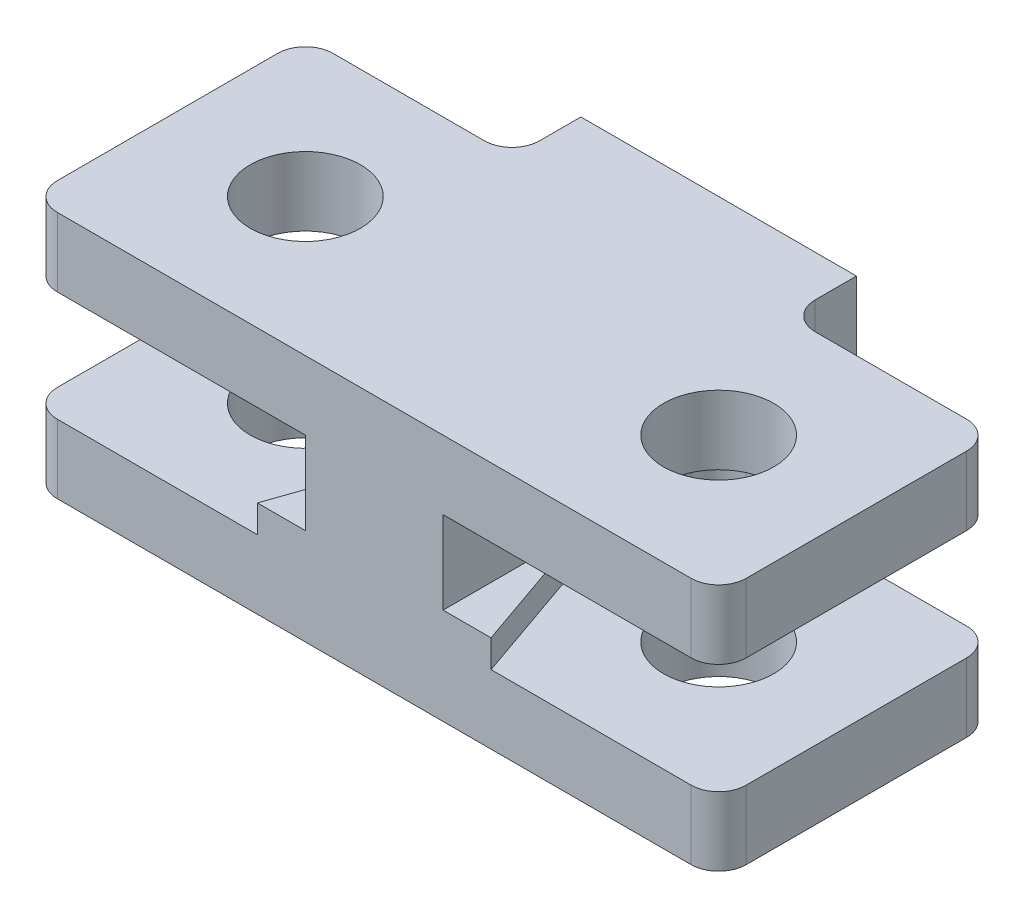
from build123d import *

# Parameters (mm, degrees)
SKETCH1_W           = 50
SKETCH1_H           = 20
BOSS_EXTRUDE1_DEPTH = 5
SKETCH2_R           = 4
CUT_EXTRUDE1_DEPTH  = 5
SKETCH3_W           = 10
SKETCH3_H           = 20
BOSS_EXTRUDE2_DEPTH = 8
FILLET1_R           = 2
SKETCH5_W           = 20
SKETCH5_H           = 18
BOSS_EXTRUDE3_DEPTH = 5
SKETCH6_R           = 4
CUT_EXTRUDE2_DEPTH  = 5
FILLET2_R           = 2
BOSS_EXTRUDE4_DEPTH = 2


with BuildPart() as part:
    # Sketch1 → Boss-Extrude1 (new body)
    with BuildSketch(Plane(origin=(0, 0, 0), x_dir=(1, 0, 0), z_dir=(0, 1, 0))):
        Rectangle(SKETCH1_W, SKETCH1_H)
    boss_extrude1 = extrude(amount=BOSS_EXTRUDE1_DEPTH)

    # Sketch2 → Cut-Extrude1 (cut)
    with BuildSketch(Plane(origin=(0, 5, 0), x_dir=(1, 0, 0), z_dir=(0, 1, 0))):
        with Locations((-15, 0)):
            Circle(SKETCH2_R)
        with Locations((15, 0)):
            Circle(SKETCH2_R)
    cut_extrude1 = extrude(amount=-CUT_EXTRUDE1_DEPTH, mode=Mode.SUBTRACT)

    # Sketch3 → Boss-Extrude2 (add)
    with BuildSketch(Plane(origin=(0, 5, 0), x_dir=(1, 0, 0), z_dir=(0, 1, 0))):
        Rectangle(SKETCH3_W, SKETCH3_H)
    extrude(amount=BOSS_EXTRUDE2_DEPTH)

    # Mirror1: Boss-Extrude1, Cut-Extrude1 across plane
    add(boss_extrude1.mirror(Plane.ZX.offset(9)))
    add(cut_extrude1.mirror(Plane.ZX.offset(9)), mode=Mode.SUBTRACT)

    # Fillet1
    fillet1_edges = [part.edges().sort_by_distance(p)[0] for p in [
        (25, 2.5, -10),
        (25, 15.5, -10),
        (25, 15.5, 10),
        (25, 2.5, 10),
        (-25, 15.5, -10),
        (-25, 15.5, 10),
        (-25, 2.5, 10),
        (-25, 2.5, -10),
    ]]
    fillet(fillet1_edges, radius=FILLET1_R)

    # Sketch5 → Boss-Extrude3 (add)
    with BuildSketch(Plane.XY.offset(-10)):
        with Locations((0, 9)):
            Rectangle(SKETCH5_W, SKETCH5_H)
    extrude(amount=-BOSS_EXTRUDE3_DEPTH)

    # Sketch6 → Cut-Extrude2 (cut)
    with BuildSketch(Plane(origin=(0, 0, -15), x_dir=(-1, 0, 0), z_dir=(0, 0, -1))):
        with Locations((0, 9)):
            Circle(SKETCH6_R)
    extrude(amount=-CUT_EXTRUDE2_DEPTH, mode=Mode.SUBTRACT)

    # Fillet2
    fillet2_edges = [part.edges().sort_by_distance(p)[0] for p in [
        (10, 2.5, -10),
        (10, 15.5, -10),
        (5, 9, -10),
        (-5, 9, -10),
        (-10, 2.5, -10),
        (-10, 15.5, -10),
    ]]
    fillet(fillet2_edges, radius=FILLET2_R)

    # Sketch2<5> → Boss-Extrude4 (add)
    with BuildSketch(Plane(origin=(0, 5, 0), x_dir=(1, 0, 0), z_dir=(0, 1, 0))):
        Polygon((-5, -10), (-5, 0), (-8.48, -10), align=None)
        Polygon((5, 0), (5, -10), (8.48, -10), align=None)
    extrude(amount=BOSS_EXTRUDE4_DEPTH)


solid = part.part
